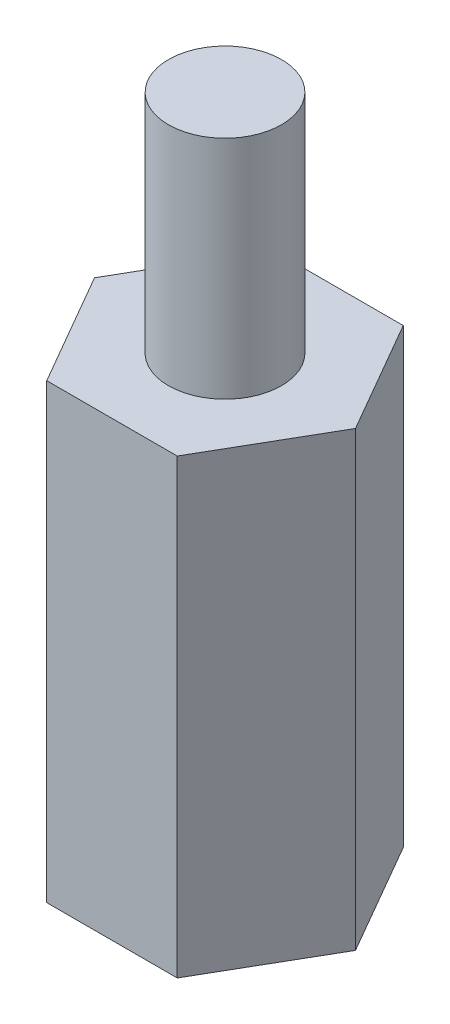
from build123d import *

# Parameters (mm, degrees)
HEX_2_DEPTH                 = 10
M3X1_0_FEMALE_THREADS_D     = 2.5
M3X1_0_FEMALE_THREADS_DEPTH = 7.5
M3X1_0_FEMALE_THREADS_TIP   = 0.751075774
M3X1_0_START                = 5
SKETCH2_R                   = 1.25
M3X1_0_MALE_THREADS_DEPTH   = 5


with BuildPart() as part:
    # Sketch1 → Hex 2 (new body)
    with BuildSketch(Plane(origin=(0, 0, 0), x_dir=(1, 0, 0), z_dir=(0, 1, 0))):
        Polygon((2.886751346, 0), (1.443375673, 2.5), (-1.443375673, 2.5), (-2.886751346, 0), (-1.443375673, -2.5), (1.443375673, -2.5), align=None)
    extrude(amount=HEX_2_DEPTH)

    # M3x1.0 Female Threads
    with Locations(Plane.XZ):
        with Locations((0, 0)):
            Hole(M3X1_0_FEMALE_THREADS_D / 2, depth=M3X1_0_FEMALE_THREADS_DEPTH)
            with Locations((0, 0, -(M3X1_0_FEMALE_THREADS_DEPTH + M3X1_0_FEMALE_THREADS_TIP / 2))):  # 118° drill point
                Cone(0, M3X1_0_FEMALE_THREADS_D / 2, M3X1_0_FEMALE_THREADS_TIP, mode=Mode.SUBTRACT)

    # Sketch2 → M3x1.0 Male Threads (add)
    with BuildSketch(Plane(origin=(0, 10, 0), x_dir=(-1, 0, 0), z_dir=(0, 1, 0)).offset(M3X1_0_START)):
        with Locations(Location((0, 0, 0), (0, 0, 270))):
            Circle(SKETCH2_R)
    extrude(amount=-M3X1_0_MALE_THREADS_DEPTH)


solid = part.part
